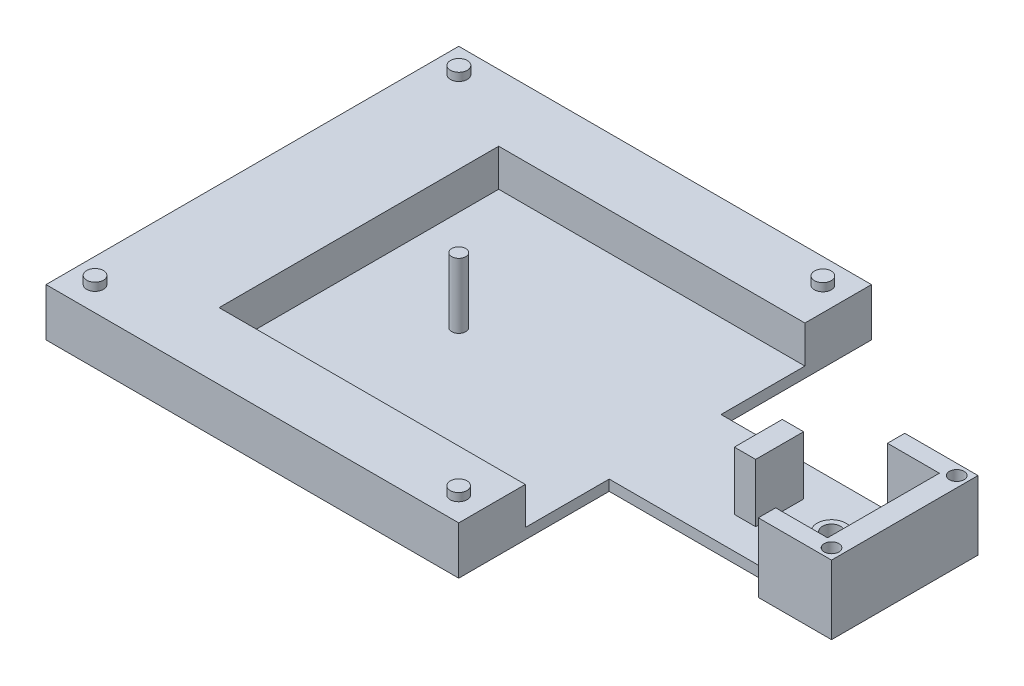
from build123d import *

# Parameters (mm, degrees)
SKETCH1_W           = 8
SKETCH1_H           = 18
SKETCH1_R           = 3.425
BOSS_EXTRUDE1_DEPTH = 4
SKETCH1_3_R         = 2.75
SKETCH1_3_W         = 8
SKETCH1_3_H         = 18
BOSS_EXTRUDE2_DEPTH = 25.9
SKETCH4_R           = 5.425
SKETCH4_R_2         = 3.425
BOSS_EXTRUDE5_DEPTH = 3.7
BOSS_EXTRUDE6_DEPTH = 14
SKETCH6_R           = 3.15
SKETCH6_R_2         = 3.175
BOSS_EXTRUDE7_DEPTH = 3
SKETCH7_R           = 2.65
BOSS_EXTRUDE8_DEPTH = 24.4


with BuildPart() as part:
    # Sketch1 → Boss-Extrude1 (new body)
    with BuildSketch(Plane(origin=(0, 0, 0), x_dir=(1, 0, 0), z_dir=(0, 1, 0))):
        Polygon((-62.5, -21), (0, -21), (19.5, -21), (19.5, 21), (0, 21), (-62.5, 21), (-62.5, 77.5), (-217.5, 77.5), (-217.5, -77.5), (-62.5, -77.5), align=None)
        with Locations((-23.5, 0)):
            Rectangle(SKETCH1_W, SKETCH1_H, mode=Mode.SUBTRACT)
        Circle(SKETCH1_R, mode=Mode.SUBTRACT)
    extrude(amount=BOSS_EXTRUDE1_DEPTH)

    # Sketch1<3> → Boss-Extrude2 (add)
    # profile 1 of 2: a face of its own
    with BuildSketch(Plane(origin=(0, 0, 0), x_dir=(1, 0, 0), z_dir=(0, 1, 0))):
        Polygon((0, -27.5), (27.5, -27.5), (27.5, 27.5), (0, 27.5), (0, 21), (19.5, 21), (19.5, -21), (0, -21), align=None)
        with Locations((23.5, -23.5)):
            Circle(SKETCH1_3_R, mode=Mode.SUBTRACT)
        with Locations((23.5, 23.5)):
            Circle(SKETCH1_3_R, mode=Mode.SUBTRACT)
    # profile 2 of 2: a face of its own
    with BuildSketch(Plane(origin=(0, 0, 0), x_dir=(1, 0, 0), z_dir=(0, 1, 0))):
        with Locations((-23.5, 0)):
            Rectangle(SKETCH1_3_W, SKETCH1_3_H)
    extrude(amount=BOSS_EXTRUDE2_DEPTH)

    # Sketch4 → Boss-Extrude5 (add)
    with BuildSketch(Plane(origin=(0, 4, 0), x_dir=(1, 0, 0), z_dir=(0, 1, 0))):
        Circle(SKETCH4_R)
        Circle(SKETCH4_R_2, mode=Mode.SUBTRACT)
    extrude(amount=BOSS_EXTRUDE5_DEPTH)

    # Sketch5 → Boss-Extrude6 (add)
    with BuildSketch(Plane(origin=(0, 4, 0), x_dir=(1, 0, 0), z_dir=(0, 1, 0))):
        Polygon((-217.5, 77.5), (-62.5, 77.5), (-62.5, 52.5), (-177.5, 52.5), (-177.5, -52.5), (-62.5, -52.5), (-62.5, -77.5), (-217.5, -77.5), align=None)
    extrude(amount=BOSS_EXTRUDE6_DEPTH)

    # Sketch6 → Boss-Extrude7 (add)
    with BuildSketch(Plane(origin=(0, 18, 0), x_dir=(1, 0, 0), z_dir=(0, 1, 0))):
        with Locations((-71.48, 68.23)):
            Circle(SKETCH6_R)
        with Locations((-71.61, -68.43)):
            Circle(SKETCH6_R)
        with Locations((-208.29, -68.29)):
            Circle(SKETCH6_R)
        with Locations((-208.265, 68.315)):
            Circle(SKETCH6_R_2)
    extrude(amount=BOSS_EXTRUDE7_DEPTH)

    # Sketch7 → Boss-Extrude8 (add)
    with BuildSketch(Plane(origin=(0, 4, 0), x_dir=(1, 0, 0), z_dir=(0, 1, 0))):
        with Locations((-140, 0)):
            Circle(SKETCH7_R)
    extrude(amount=BOSS_EXTRUDE8_DEPTH)


solid = part.part
